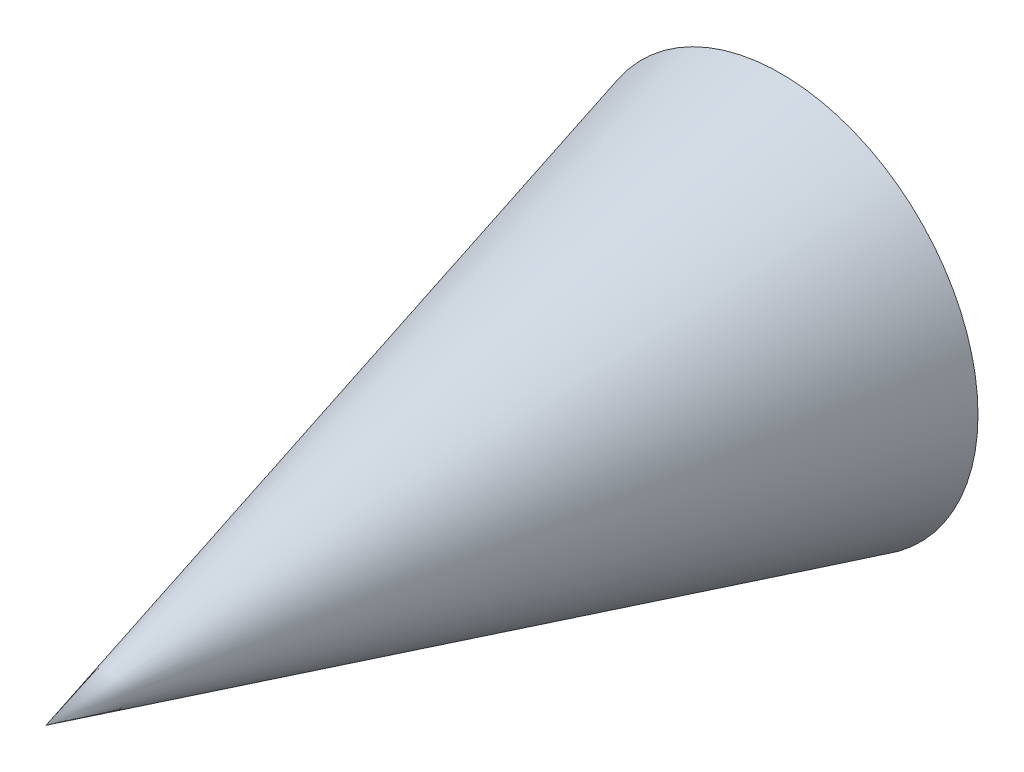
from build123d import *


with BuildPart() as part:
    # 草圖1 → 旋轉1 (revolve)
    with BuildSketch(Plane(origin=(0, 0, 0), x_dir=(0, 0, -1), z_dir=(1, 0, 0)), mode=Mode.PRIVATE) as revolve_1_sk:
        Polygon((0, 0), (27.990381057, 7.5), (27.990381057, 6.46472382), (3.863703305, 0), align=None)
    revolve(revolve_1_sk.sketch.rotate(Axis((0, 0, 0), (0, 0, -1)), 270), axis=Axis((0, 0, 0), (0, 0, -1)))


solid = part.part
